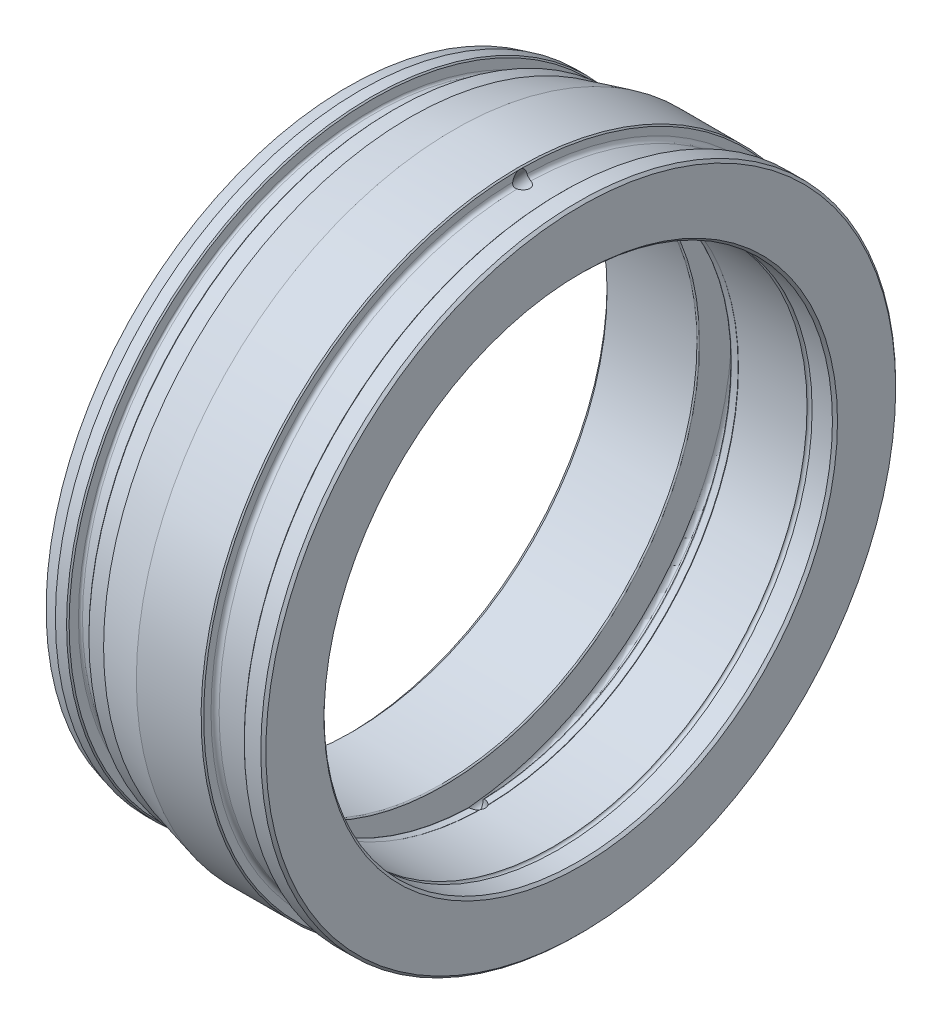
from build123d import *

# Parameters (mm, degrees)
SKETCH2_R          = 1.5
CUT_EXTRUDE1_DEPTH = 142.654606394
CIRPATTERN1_COUNT  = 2
FILLET1_R          = 0.25
CUT_EXTRUDE2_DEPTH = 0.01


with BuildPart() as part:
    # Sketch1 → Revolve1 (revolve)
    with BuildSketch(Plane.XY, mode=Mode.PRIVATE) as revolve1_sk:
        with BuildLine():
            Line((0, 50.545), (0, 62.0025))
            Line((0, 62.0025), (-0.5, 62.5025))
            Line((-0.5, 62.5025), (-3.75, 62.5025))
            Line((-3.75, 62.5025), (-4, 62.2525))
            Line((-4, 62.2525), (-4, 60.8))
            ThreePointArc((-4, 60.8), (-4.234314575, 60.234314575), (-4.8, 60))
            Line((-4.8, 60), (-11.2, 60))
            ThreePointArc((-11.2, 60), (-11.765685425, 60.234314575), (-12, 60.8))
            Line((-12, 60.8), (-12, 62.2525))
            Line((-12, 62.2525), (-12.25, 62.5025))
            Line((-12.25, 62.5025), (-25, 62.5025))
            Line((-25, 62.5025), (-33.7, 60.25))
            Line((-33.7, 60.25), (-33.7, 59.99))
            Line((-33.7, 59.99), (-36.85, 59.99))
            Line((-36.85, 59.99), (-37.1, 59.74))
            Line((-37.1, 59.74), (-37.1, 57.9))
            ThreePointArc((-37.1, 57.9), (-37.217157288, 57.617157288), (-37.5, 57.5))
            Line((-37.5, 57.5), (-40.6, 57.5))
            ThreePointArc((-40.6, 57.5), (-40.882842712, 57.617157288), (-41, 57.9))
            Line((-41, 57.9), (-41, 59.74))
            Line((-41, 59.74), (-41.25, 59.99))
            Line((-41.25, 59.99), (-43.45, 59.99))
            Line((-43.45, 59.99), (-45.95, 59.320127019))
            Line((-45.95, 59.320127019), (-45.95, 51.125))
            Line((-45.95, 51.125), (-44.95, 50.125))
            Line((-44.95, 50.125), (-27, 50.125))
            Line((-27, 50.125), (-27, 56.75))
            ThreePointArc((-27, 56.75), (-26.765685425, 57.315685425), (-26.2, 57.55))
            Line((-26.2, 57.55), (-21.5, 57.55))
            ThreePointArc((-21.5, 57.55), (-20.934314575, 57.315685425), (-20.7, 56.75))
            Line((-20.7, 56.75), (-20.7, 50.125))
            Line((-20.7, 50.125), (-19.138564065, 50.125))
            Line((-19.138564065, 50.125), (-19, 50.045))
            Line((-19, 50.045), (-5.5, 50.045))
            ThreePointArc((-5.5, 50.045), (-5, 50.445), (-4.5, 50.045))
            Line((-4.5, 50.045), (-0.5, 50.045))
            Line((-0.5, 50.045), (0, 50.545))
        make_face()
    revolve(revolve1_sk.sketch.rotate(Axis((0, 0, 0), (-1, 0, 0)), 90), axis=Axis((0, 0, 0), (-1, 0, 0)))

    # Sketch2 → Cut-Extrude1 (cut, symmetric)
    with BuildSketch(Plane(origin=(-12, 60, 0), x_dir=(0.7503365607322025, -0.6610560079362185, 0), z_dir=(-0.6610560079362185, -0.7503365607322025, 0))):
        with Locations(Location((0, 0, 0), (0, 0, 186.989801262))):
            Circle(SKETCH2_R)
    cut_extrude1 = extrude(amount=CUT_EXTRUDE1_DEPTH, both=True, mode=Mode.SUBTRACT)

    # CirPattern1: Cut-Extrude1 ×2 about axis
    cirpattern1_axis = Axis((-44.95, 0, 0), (1, 0, 0))
    for i in range(1, CIRPATTERN1_COUNT):
        add(cut_extrude1.rotate(cirpattern1_axis, i * 360 / CIRPATTERN1_COUNT), mode=Mode.SUBTRACT)

    # Fillet1
    fillet1_edges = [part.edges().sort_by_distance(p)[0] for p in [
        (-27, 0, 50.125),
        (-20.7, 0, 50.125),
        (-20.7, 0, -50.125),
    ]]
    fillet(fillet1_edges, radius=FILLET1_R)

    # Sketch3 → Cut-Extrude2 (cut)
    with BuildSketch(Plane.ZY.offset(45.95)):
        Polygon((-7.088400188, 55.487621534), (-6.410415412, 55.56825054), (-5.99955804, 52.119432431), (-6.342406598, 52.078767367), (-6.713300028, 55.189644771), (-7.254566053, 55.125141566), align=None)
        Polygon((-4.184736873, 55.782023718), (-3.500442001, 55.819183174), (-3.311840238, 52.338113462), (-3.657493283, 52.319183174), (-3.827865879, 55.459507693), (-4.374740879, 55.430060577), align=None)
        Polygon((-1.326334379, 55.93482257), (-0.679198963, 55.93482257), (-0.679198963, 52.43482257), (-0.993301527, 52.43482257), (-0.993301527, 55.575848212), (-1.531763065, 55.575848212), align=None)
        Polygon((1.459617342, 55.939659956), (2.143912214, 55.924235276), (2.065386573, 52.443165565), (1.719733528, 52.450877904), (1.790546829, 55.591202424), (1.243671829, 55.603822616), align=None)
        Polygon((4.330415968, 55.800025665), (5.014710839, 55.749544896), (4.758801384, 52.268475185), (4.413148339, 52.294416691), (4.64381741, 55.43474121), (4.09694241, 55.474705153), align=None)
        Polygon((6.189360449, 53.573698337), (7.478723429, 53.413141446), (7.442966218, 53.127083754), (6.153603237, 53.287640645), align=None)
        Polygon((9.67777724, 55.111238801), (10.076715541, 55.035517647), (10.639716342, 53.545633833), (11.718742785, 54.722116205), (12.113474355, 54.647096173), (10.781342945, 53.184556109), (11.5294399, 51.217909474), (11.130501599, 51.293630628), (10.516318906, 52.895693929), (9.351054483, 51.632973577), (8.952116182, 51.708694731), (10.376795669, 53.261679506), align=None)
        Polygon((12.756794683, 54.489275176), (13.152928497, 54.391819247), (13.638805901, 52.871787196), (14.779531061, 53.992179824), (15.170055901, 53.89682726), (13.760099972, 52.502997132), (14.406534266, 50.495685433), (14.010400452, 50.593141362), (13.480352375, 52.228157388), (12.248481382, 51.02573351), (11.852347568, 51.123189439), (13.359759427, 52.601855305), align=None)
    extrude(amount=-CUT_EXTRUDE2_DEPTH, mode=Mode.SUBTRACT)


solid = part.part
